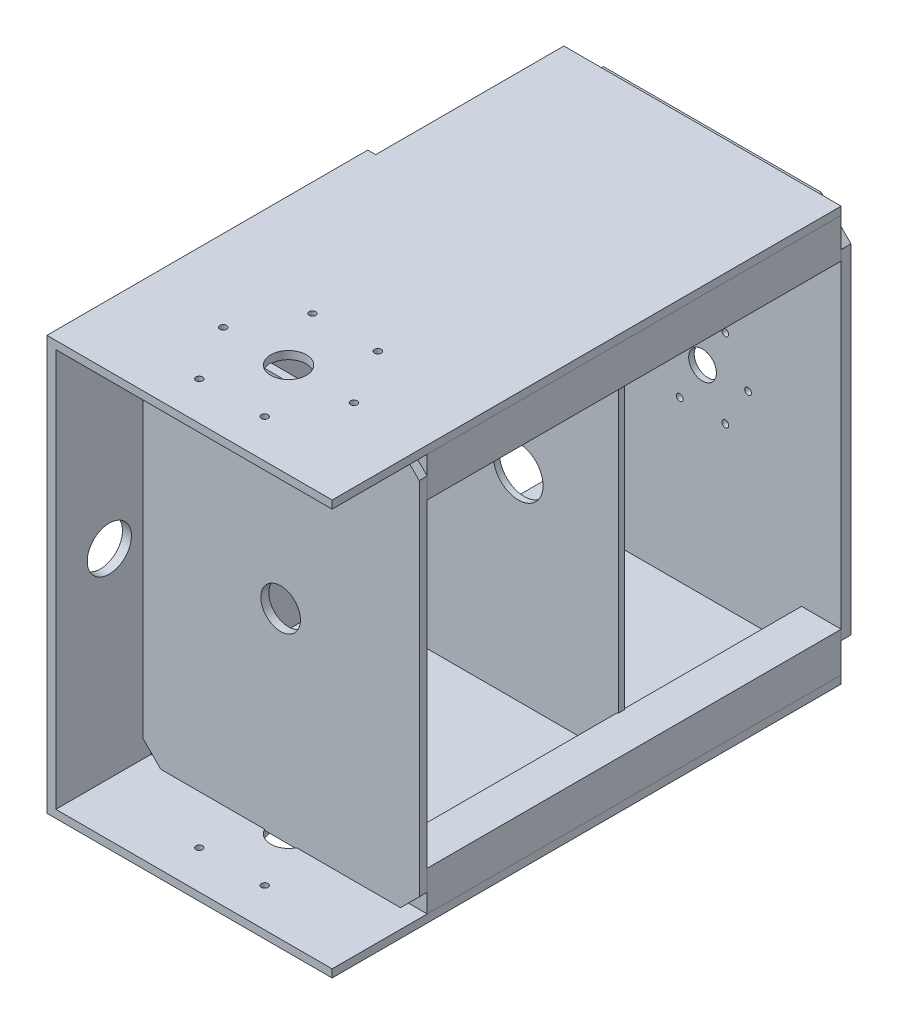
from build123d import *

# Parameters (mm, degrees)
SK_BOTTOM_PLATE_R        = 1.7
SK_BOTTOM_PLATE_R_2      = 7
SK_BOTTOM_PLATE_R_3      = 2.75
BOTTOM_PLATE_DEPTH       = 5
SK_WAIST_PILOT_RECESS_R  = 17.15
WAIST_PILOT_RECESS_DEPTH = 2.2
SK_SIDE_LEFT_W           = 140
SK_SIDE_LEFT_H           = 257
SK_SIDE_LEFT_R           = 1.7
SK_SIDE_LEFT_R_2         = 9
SIDE_LEFT_DEPTH          = 4
SK_SIDE_RIGHT_W          = 140
SK_SIDE_RIGHT_H          = 257
SK_SIDE_RIGHT_R          = 1.7
SK_SIDE_RIGHT_R_2        = 9
SIDE_RIGHT_DEPTH         = 4
SK_DECK_R                = 10
DECK_DEPTH               = 4
SK_TRAY_W                = 101
SK_TRAY_H                = 202
SK_TRAY_R                = 12.5
TRAY_DEPTH               = 3
SK_BACK_PLATE_W          = 162
SK_BACK_PLATE_H          = 209
SK_BACK_PLATE_R          = 11.15
BACK_PLATE_DEPTH         = 4.5
SK_POST_0_W              = 20
SK_POST_0_H              = 20
POST_0_DEPTH             = 209
SK_POST_1_W              = 20
SK_POST_1_H              = 20
POST_1_DEPTH             = 209
SK_POST_2_W              = 20
SK_POST_2_H              = 20
POST_2_DEPTH             = 209
SK_POST_3_W              = 20
SK_POST_3_H              = 20
POST_3_DEPTH             = 209


with BuildPart() as part:
    # SK_Bottom_Plate → Bottom_Plate (new body)
    with BuildSketch(Plane.XY):
        Polygon((-55, -100.5), (55, -100.5), (70, -85.5), (70, 85.5), (55, 100.5), (-55, 100.5), (-70, 85.5), (-70, -85.5), align=None)
        with Locations((23, 0)):
            Circle(SK_BOTTOM_PLATE_R, mode=Mode.SUBTRACT)
        with Locations((11.5, 19.918584287)):
            Circle(SK_BOTTOM_PLATE_R, mode=Mode.SUBTRACT)
        with Locations((-11.5, 19.918584287)):
            Circle(SK_BOTTOM_PLATE_R, mode=Mode.SUBTRACT)
        with Locations((-23, 0)):
            Circle(SK_BOTTOM_PLATE_R, mode=Mode.SUBTRACT)
        with Locations((-11.5, -19.918584287)):
            Circle(SK_BOTTOM_PLATE_R, mode=Mode.SUBTRACT)
        with Locations((11.5, -19.918584287)):
            Circle(SK_BOTTOM_PLATE_R, mode=Mode.SUBTRACT)
        Circle(SK_BOTTOM_PLATE_R_2, mode=Mode.SUBTRACT)
        with Locations((60, 90.5)):
            Circle(SK_BOTTOM_PLATE_R_3, mode=Mode.SUBTRACT)
        with Locations((60, -90.5)):
            Circle(SK_BOTTOM_PLATE_R_3, mode=Mode.SUBTRACT)
        with Locations((-60, 90.5)):
            Circle(SK_BOTTOM_PLATE_R_3, mode=Mode.SUBTRACT)
        with Locations((-60, -90.5)):
            Circle(SK_BOTTOM_PLATE_R_3, mode=Mode.SUBTRACT)
    extrude(amount=BOTTOM_PLATE_DEPTH)

    # SK_Waist_Pilot_Recess → Waist_Pilot_Recess (cut)
    with BuildSketch(Plane.XY):
        Circle(SK_WAIST_PILOT_RECESS_R)
    extrude(amount=WAIST_PILOT_RECESS_DEPTH, mode=Mode.SUBTRACT)


with BuildPart() as body_2:
    # SK_Side_Left → Side_Left (new body)
    with BuildSketch(Plane(origin=(0, 100.5, 0), x_dir=(1, 0, 0), z_dir=(0, 1, 0))):
        with Locations((0, -133.5)):
            Rectangle(SK_SIDE_LEFT_W, SK_SIDE_LEFT_H)
        with Locations(Location((33, -214, 0), (0, 0, 270))):
            Circle(SK_SIDE_LEFT_R, mode=Mode.SUBTRACT)
        with Locations(Location((16.5, -185.421161675, 0), (0, 0, 270))):
            Circle(SK_SIDE_LEFT_R, mode=Mode.SUBTRACT)
        with Locations(Location((-16.5, -185.421161675, 0), (0, 0, 270))):
            Circle(SK_SIDE_LEFT_R, mode=Mode.SUBTRACT)
        with Locations(Location((-33, -214, 0), (0, 0, 270))):
            Circle(SK_SIDE_LEFT_R, mode=Mode.SUBTRACT)
        with Locations(Location((-16.5, -242.578838325, 0), (0, 0, 270))):
            Circle(SK_SIDE_LEFT_R, mode=Mode.SUBTRACT)
        with Locations(Location((16.5, -242.578838325, 0), (0, 0, 270))):
            Circle(SK_SIDE_LEFT_R, mode=Mode.SUBTRACT)
        with Locations(Location((0, -214, 0), (0, 0, 270))):
            Circle(SK_SIDE_LEFT_R_2, mode=Mode.SUBTRACT)
    extrude(amount=SIDE_LEFT_DEPTH)



with BuildPart() as body_3:
    # SK_Side_Right → Side_Right (new body)
    with BuildSketch(Plane(origin=(0, -104.5, 0), x_dir=(1, 0, 0), z_dir=(0, 1, 0))):
        with Locations((0, -133.5)):
            Rectangle(SK_SIDE_RIGHT_W, SK_SIDE_RIGHT_H)
        with Locations(Location((33, -214, 0), (0, 0, 270))):
            Circle(SK_SIDE_RIGHT_R, mode=Mode.SUBTRACT)
        with Locations(Location((16.5, -185.421161675, 0), (0, 0, 270))):
            Circle(SK_SIDE_RIGHT_R, mode=Mode.SUBTRACT)
        with Locations(Location((-16.5, -185.421161675, 0), (0, 0, 270))):
            Circle(SK_SIDE_RIGHT_R, mode=Mode.SUBTRACT)
        with Locations(Location((-33, -214, 0), (0, 0, 270))):
            Circle(SK_SIDE_RIGHT_R, mode=Mode.SUBTRACT)
        with Locations(Location((-16.5, -242.578838325, 0), (0, 0, 270))):
            Circle(SK_SIDE_RIGHT_R, mode=Mode.SUBTRACT)
        with Locations(Location((16.5, -242.578838325, 0), (0, 0, 270))):
            Circle(SK_SIDE_RIGHT_R, mode=Mode.SUBTRACT)
        with Locations(Location((0, -214, 0), (0, 0, 270))):
            Circle(SK_SIDE_RIGHT_R_2, mode=Mode.SUBTRACT)
    extrude(amount=SIDE_RIGHT_DEPTH)


with BuildPart() as body_2_1:
    add(body_2.part)

    add(body_3.part)  # Deck merges body 3
    # SK_Deck → Deck (add)
    with BuildSketch(Plane.XY.offset(214)):
        Polygon((-60, -101), (60, -101), (70, -91), (70, 91), (60, 101), (-60, 101), (-70, 91), (-70, -91), align=None)
        Circle(SK_DECK_R, mode=Mode.SUBTRACT)
    extrude(amount=DECK_DEPTH)

    # SK_Tray → Tray (add)
    with BuildSketch(Plane.XY.offset(95)):
        Rectangle(SK_TRAY_W, SK_TRAY_H)
        Circle(SK_TRAY_R, mode=Mode.SUBTRACT)
    extrude(amount=TRAY_DEPTH)

    # SK_Back_Plate → Back_Plate (add)
    with BuildSketch(Plane(origin=(-74, 0, 0), x_dir=(0, 0, -1), z_dir=(1, 0, 0))):
        with Locations((-181, 0)):
            Rectangle(SK_BACK_PLATE_W, SK_BACK_PLATE_H)
        with Locations((-235, 0)):
            Circle(SK_BACK_PLATE_R, mode=Mode.SUBTRACT)
    extrude(amount=BACK_PLATE_DEPTH)


with BuildPart() as body_3_2:
    # SK_Post_0 → Post_0 (new body)
    with BuildSketch(Plane.XY.offset(5)):
        with Locations((60, 90.5)):
            Rectangle(SK_POST_0_W, SK_POST_0_H)
    extrude(amount=POST_0_DEPTH)


with BuildPart() as body_4:
    # SK_Post_1 → Post_1 (new body)
    with BuildSketch(Plane.XY.offset(5)):
        with Locations((60, -90.5)):
            Rectangle(SK_POST_1_W, SK_POST_1_H)
    extrude(amount=POST_1_DEPTH)


with BuildPart() as body_5:
    # SK_Post_2 → Post_2 (new body)
    with BuildSketch(Plane.XY.offset(5)):
        with Locations((-60, 90.5)):
            Rectangle(SK_POST_2_W, SK_POST_2_H)
    extrude(amount=POST_2_DEPTH)


with BuildPart() as body_6:
    # SK_Post_3 → Post_3 (new body)
    with BuildSketch(Plane.XY.offset(5)):
        with Locations((-60, -90.5)):
            Rectangle(SK_POST_3_W, SK_POST_3_H)
    extrude(amount=POST_3_DEPTH)


solid = Compound([part.part, body_2_1.part, body_3_2.part, body_4.part, body_5.part, body_6.part])
